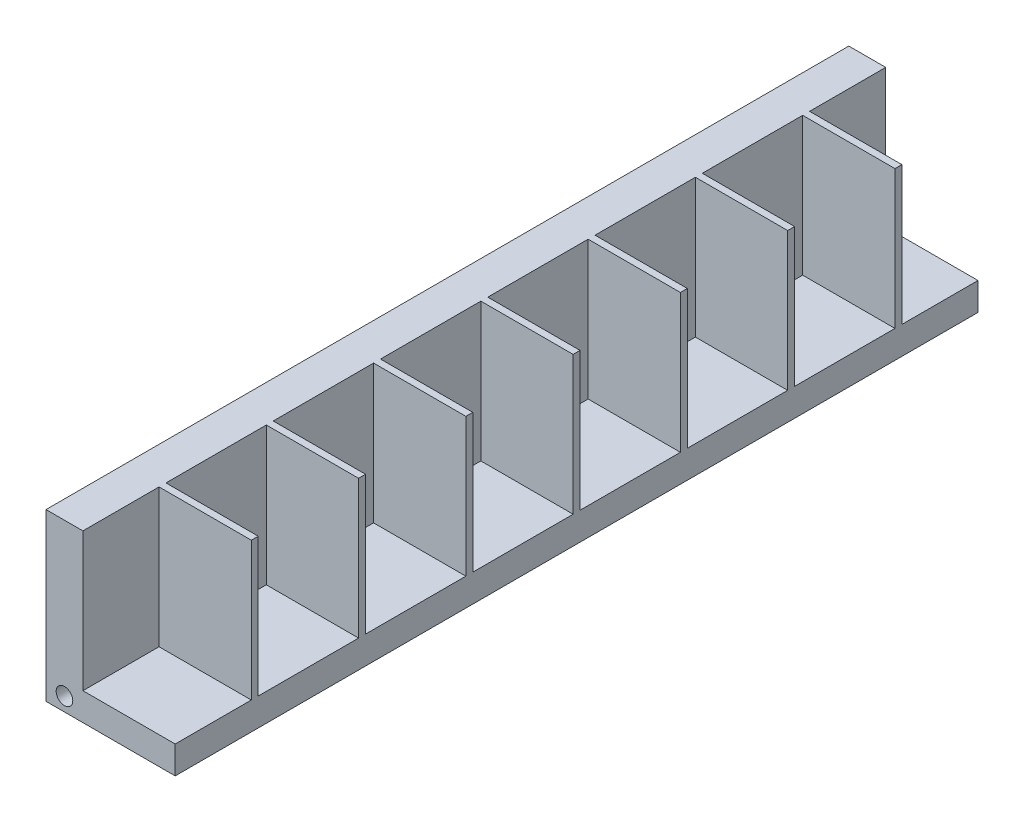
from build123d import *

# Parameters (mm, degrees)
LEG_DEPTH              = 184
SKETCH5_W              = 20
SKETCH5_H              = 21.25
CELL_SLOTS_DEPTH       = 30
SKETCH6_W              = 20
SKETCH6_H              = 0.25
CELL_SLOTS_TRIM_DEPTH  = 30
SKETCH7_R              = 1.8
SCREW_HOLE_FRONT_DEPTH = 10
SCREW_START            = -10
SKETCH8_R              = 1.8
SCREW_HOLE_BACK_DEPTH  = 10
SKETCH9_W              = 28
SKETCH9_H              = 36
FRONT_TRIM_DEPTH       = 5
SKETCH10_W             = 28
SKETCH10_H             = 36
BACK_TRIM_DEPTH        = 5


with BuildPart() as part:
    # Sketch1 → Leg (new body)
    with BuildSketch(Plane.XY):
        Polygon((0, -6), (0, 0), (0, 30), (-28, 30), (-28, -6), align=None)
    extrude(amount=-LEG_DEPTH)

    # Sketch5 → Cell Slots (cut)
    with BuildSketch(Plane(origin=(0, 30, 0), x_dir=(1, 0, 0), z_dir=(0, 1, 0))):
        with Locations((-10, 33.875)):
            Rectangle(SKETCH5_W, SKETCH5_H)
        with Locations((-10, 10.625)):
            Rectangle(SKETCH5_W, SKETCH5_H)
        with Locations((-10, 57.125)):
            Rectangle(SKETCH5_W, SKETCH5_H)
        with Locations((-10, 80.375)):
            Rectangle(SKETCH5_W, SKETCH5_H)
        with Locations((-10, 103.625)):
            Rectangle(SKETCH5_W, SKETCH5_H)
        with Locations((-10, 126.875)):
            Rectangle(SKETCH5_W, SKETCH5_H)
        with Locations((-10, 150.125)):
            Rectangle(SKETCH5_W, SKETCH5_H)
        with Locations((-10, 173.375)):
            Rectangle(SKETCH5_W, SKETCH5_H)
    extrude(amount=-CELL_SLOTS_DEPTH, mode=Mode.SUBTRACT)

    # Sketch6 → Cell Slots Trim (cut)
    with BuildSketch(Plane(origin=(0, 30, 0), x_dir=(1, 0, 0), z_dir=(0, 1, 0))):
        with Locations((-10, 21.375)):
            Rectangle(SKETCH6_W, SKETCH6_H)
        with Locations((-10, 23.125)):
            Rectangle(SKETCH6_W, SKETCH6_H)
        with Locations((-10, 44.625)):
            Rectangle(SKETCH6_W, SKETCH6_H)
        with Locations((-10, 46.375)):
            Rectangle(SKETCH6_W, SKETCH6_H)
        with Locations((-10, 67.875)):
            Rectangle(SKETCH6_W, SKETCH6_H)
        with Locations((-10, 69.625)):
            Rectangle(SKETCH6_W, SKETCH6_H)
        with Locations((-10, 91.125)):
            Rectangle(SKETCH6_W, SKETCH6_H)
        with Locations((-10, 92.875)):
            Rectangle(SKETCH6_W, SKETCH6_H)
        with Locations((-10, 114.375)):
            Rectangle(SKETCH6_W, SKETCH6_H)
        with Locations((-10, 116.125)):
            Rectangle(SKETCH6_W, SKETCH6_H)
        with Locations((-10, 137.625)):
            Rectangle(SKETCH6_W, SKETCH6_H)
        with Locations((-10, 139.375)):
            Rectangle(SKETCH6_W, SKETCH6_H)
        with Locations((-10, 160.875)):
            Rectangle(SKETCH6_W, SKETCH6_H)
        with Locations((-10, 162.625)):
            Rectangle(SKETCH6_W, SKETCH6_H)
    extrude(amount=-CELL_SLOTS_TRIM_DEPTH, mode=Mode.SUBTRACT)

    # Sketch7 → Screw Hole Front (cut)
    with BuildSketch(Plane.XY):
        with Locations((-24, -3)):
            Circle(SKETCH7_R)
    extrude(amount=-SCREW_HOLE_FRONT_DEPTH, mode=Mode.SUBTRACT)

    # Sketch8 → Screw Hole Back (cut)
    with BuildSketch(Plane(origin=(0, 0, -184), x_dir=(-1, 0, 0), z_dir=(0, 0, -1)).offset(SCREW_START)):
        with Locations((24, -3)):
            Circle(SKETCH8_R)
    extrude(amount=SCREW_HOLE_BACK_DEPTH, mode=Mode.SUBTRACT)

    # Sketch9 → Front Trim (cut)
    with BuildSketch(Plane.XY):
        with Locations((-14, 12)):
            Rectangle(SKETCH9_W, SKETCH9_H)
    extrude(amount=-FRONT_TRIM_DEPTH, mode=Mode.SUBTRACT)

    # Sketch10 → Back Trim (cut)
    with BuildSketch(Plane(origin=(0, 0, -184), x_dir=(-1, 0, 0), z_dir=(0, 0, -1))):
        with Locations((14, 12)):
            Rectangle(SKETCH10_W, SKETCH10_H)
    extrude(amount=-BACK_TRIM_DEPTH, mode=Mode.SUBTRACT)


solid = part.part
